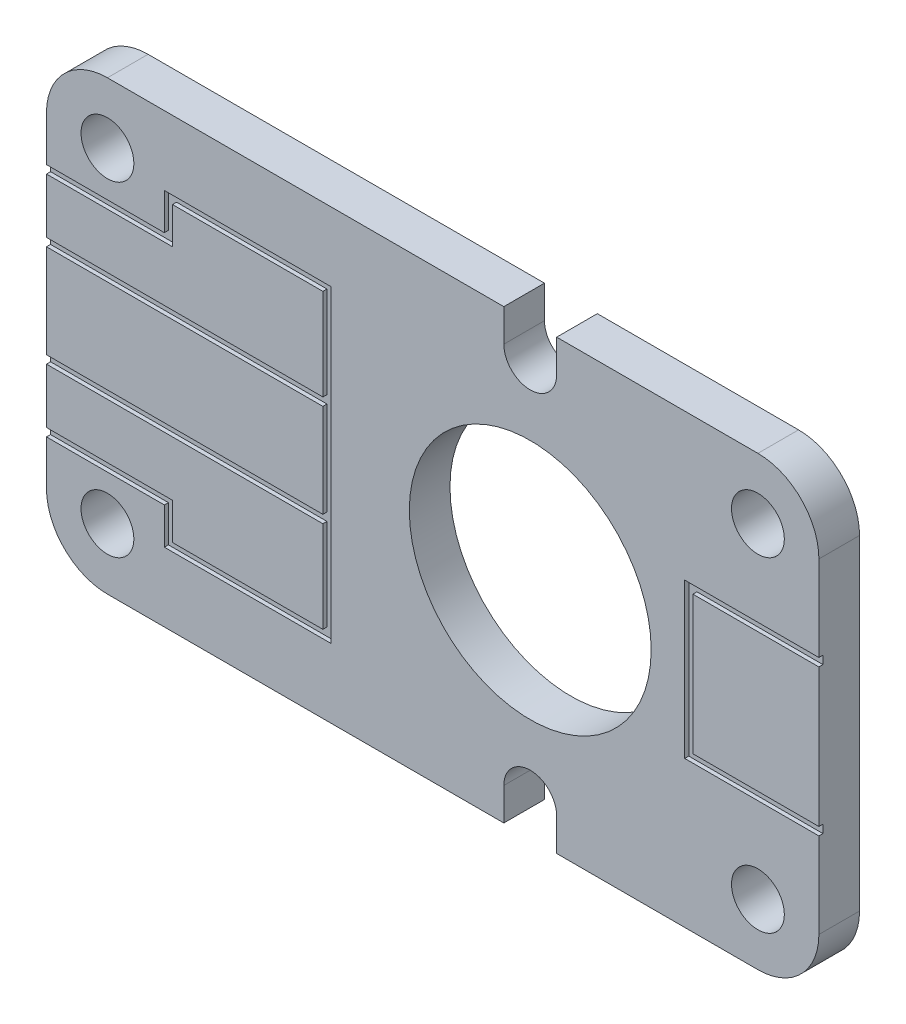
from build123d import *

# Parameters (mm, degrees)
MODEL_R             = 0.65
MODEL_R_2           = 2.974594
EXTRUDE_1_DEPTH     = 1
CUT_EXTRUDE_1_DEPTH = 0.1


with BuildPart() as part:
    # Model → Бобышка-Вытянуть1 (new body)
    with BuildSketch(Plane.XY):
        with BuildLine():
            Line((-10.4, -5.5), (-4.7, -5.5))
            Line((-4.7, -5.5), (-0.65, -5.5))
            Line((-0.65, -5.5), (-0.65, -4.7))
            ThreePointArc((-0.65, -4.7), (0, -4.05), (0.65, -4.7))
            Line((0.65, -4.7), (0.65, -5.5))
            Line((0.65, -5.5), (3.6, -5.5))
            Line((3.6, -5.5), (5.6, -5.5))
            ThreePointArc((5.6, -5.5), (6.660660172, -5.060660172), (7.1, -4))
            Line((7.1, -4), (7.1, -1.6))
            Line((7.1, -1.6), (7.1, 1.6))
            Line((7.1, 1.6), (7.1, 4))
            ThreePointArc((7.1, 4), (6.660660172, 5.060660172), (5.6, 5.5))
            Line((5.6, 5.5), (3.6, 5.5))
            Line((3.6, 5.5), (0.65, 5.5))
            Line((0.65, 5.5), (0.65, 4.7))
            ThreePointArc((0.65, 4.7), (0, 4.05), (-0.65, 4.7))
            Line((-0.65, 4.7), (-0.65, 5.5))
            Line((-0.65, 5.5), (-4.7, 5.5))
            Line((-4.7, 5.5), (-10.4, 5.5))
            ThreePointArc((-10.4, 5.5), (-11.460660172, 5.060660172), (-11.9, 4))
            Line((-11.9, 4), (-11.9, 2.6))
            Line((-11.9, 2.6), (-11.9, 1.5))
            Line((-11.9, 1.5), (-11.9, 1))
            Line((-11.9, 1), (-11.9, -1))
            Line((-11.9, -1), (-11.9, -1.5))
            Line((-11.9, -1.5), (-11.9, -2.6))
            Line((-11.9, -2.6), (-11.9, -4))
            ThreePointArc((-11.9, -4), (-11.460660172, -5.060660172), (-10.4, -5.5))
        make_face()
        with Locations((5.6, -4)):
            Circle(MODEL_R, mode=Mode.SUBTRACT)
        Circle(MODEL_R_2, mode=Mode.SUBTRACT)
        with Locations((5.6, 4)):
            Circle(MODEL_R, mode=Mode.SUBTRACT)
        with Locations((-10.4, -4)):
            Circle(MODEL_R, mode=Mode.SUBTRACT)
        with Locations((-10.4, 4)):
            Circle(MODEL_R, mode=Mode.SUBTRACT)
    extrude(amount=-EXTRUDE_1_DEPTH)

    # Model<3> → Вырез-Вытянуть1 (cut)
    with BuildSketch(Plane.XY):
        Polygon((-11.9, -2.7), (-11.9, -2.900000006), (-9.000000006, -2.900000006), (-9.000000006, -3.800000006), (-4.899999994, -3.800000006), (-4.899999994, 3.800000006), (-9.000000006, 3.800000006), (-9.000000006, 2.900000006), (-11.9, 2.900000006), (-11.9, 2.7), (-8.8, 2.7), (-8.8, 3.6), (-5.1, 3.6), (-5.1, 1.35), (-11.9, 1.35), (-11.9, 1.15), (-5.1, 1.15), (-5.1, -1.15), (-11.9, -1.15), (-11.9, -1.35), (-5.1, -1.35), (-5.1, -3.6), (-8.8, -3.6), (-8.8, -2.7), align=None)
        Polygon((3.799999994, -1.900000006), (7.1, -1.900000006), (7.1, -1.7), (4, -1.7), (4, 1.7), (7.1, 1.7), (7.1, 1.900000006), (3.799999994, 1.900000006), align=None)
    extrude(amount=-CUT_EXTRUDE_1_DEPTH, mode=Mode.SUBTRACT)


solid = part.part
